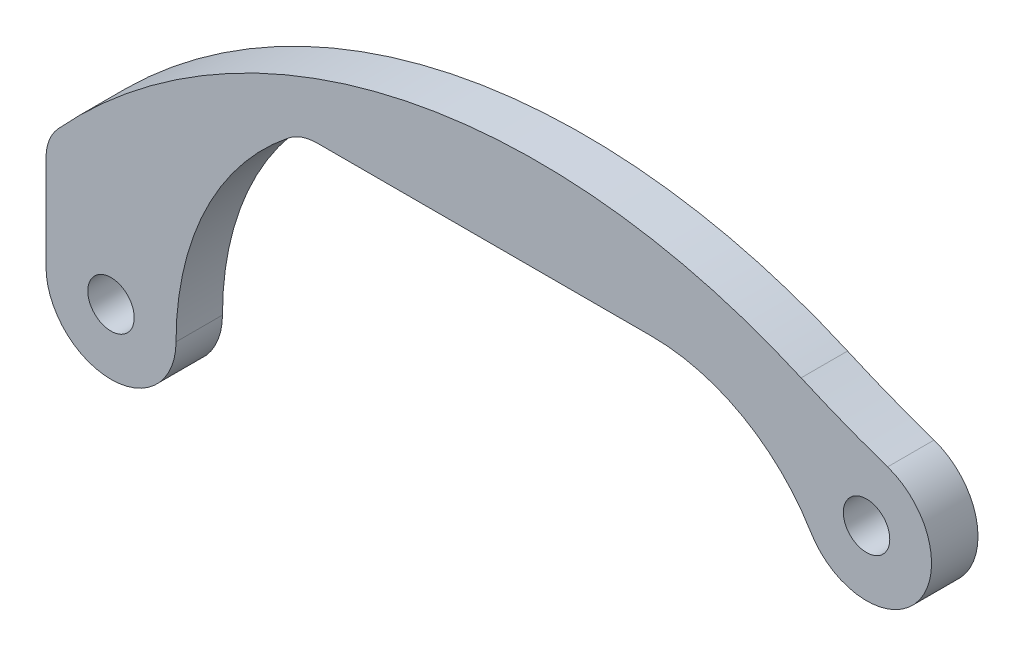
from build123d import *

# Parameters (mm, degrees)
SKETCH1_R      = 3.175
EXTRUDE1_DEPTH = 3.175


with BuildPart() as part:
    # Sketch1 → Extrude1 (new, symmetric)
    with BuildSketch(Plane.XY):
        with BuildLine():
            Line((-30.671954233, -68.444522869), (15.048045767, -68.444522869))
            ThreePointArc((15.048045767, -68.444522869), (27.561669737, -71.74092101), (36.827271125, -80.774505929))
            ThreePointArc((36.827271125, -80.774505929), (51.362538063, -81.790073124), (47.328528799, -67.788925636))
            ThreePointArc((47.328528799, -67.788925636), (41.365390525, -65.602009691), (35.503100856, -63.157591707))
            ThreePointArc((35.503100856, -63.157591707), (-18.723497615, -57.436104054), (-66.09004738, -84.448496879))
            ThreePointArc((-66.09004738, -84.448496879), (-67.32359299, -86.435368185), (-67.754245932, -88.734026577))
            Line((-67.754245932, -88.734026577), (-67.754245932, -101.636771367))
            ThreePointArc((-67.754245932, -101.636771367), (-58.864245932, -110.526771367), (-49.974245932, -101.636771367))
            ThreePointArc((-49.974245932, -101.636771367), (-45.935885769, -83.975243651), (-34.623381697, -69.82373611))
            ThreePointArc((-34.623381697, -69.82373611), (-32.764560752, -68.799233221), (-30.671954233, -68.444522869))
        make_face()
        with Locations((44.45, -76.2)):
            Circle(SKETCH1_R, mode=Mode.SUBTRACT)
        with Locations((-58.864245932, -101.636771367)):
            Circle(SKETCH1_R, mode=Mode.SUBTRACT)
    extrude(amount=EXTRUDE1_DEPTH, both=True)


solid = part.part
